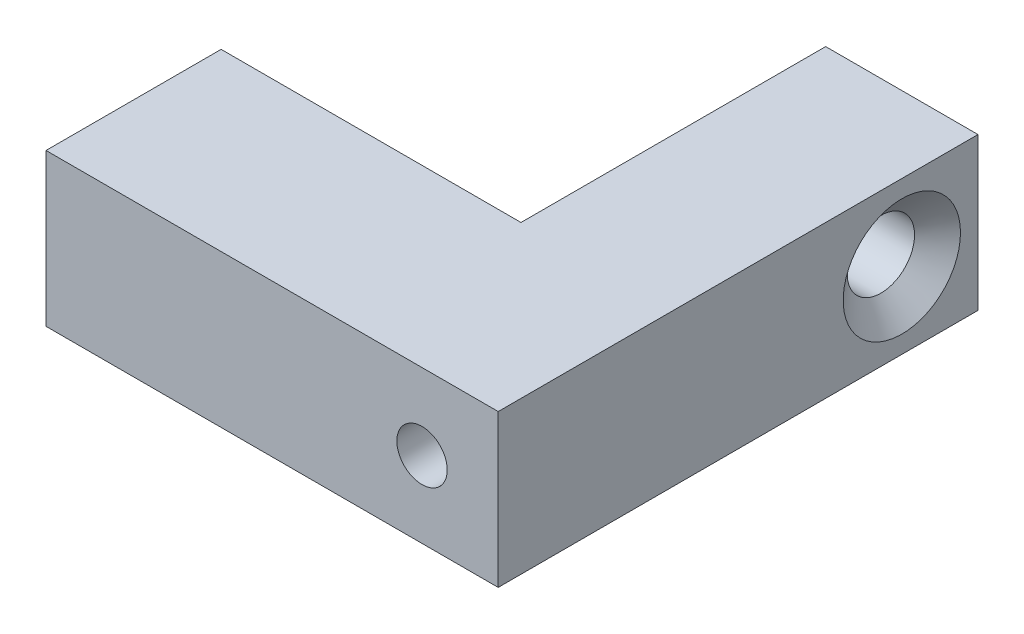
from build123d import *

# Parameters (mm, degrees)
SKETCH1_W                                          = 12.7
SKETCH1_H                                          = 40
BOSS_EXTRUDE1_DEPTH                                = 12.7
CSK_FOR_10_FLAT_HEAD_MACHINE_SCREW_100_D           = 5.6134
CSK_FOR_10_FLAT_HEAD_MACHINE_SCREW_100_DEPTH       = 12.7
CSK_FOR_10_FLAT_HEAD_MACHINE_SCREW_100_CSINK_D     = 9.779
CSK_FOR_10_FLAT_HEAD_MACHINE_SCREW_100_CSINK_ANGLE = 100
CSK_FOR_10_FLAT_HEAD_MACHINE_SCREW_100_TIP         = 1.686435499
TAP_DRILL_FOR_M5X0_8_TAP1_D                        = 4.2
TAP_DRILL_FOR_M5X0_8_TAP1_DEPTH                    = 12.7
TAP_DRILL_FOR_M5X0_8_TAP1_TIP                      = 1.2618073
SKETCH8_W                                          = 14.6
SKETCH8_H                                          = 12.7
BOSS_EXTRUDE2_DEPTH                                = 25


with BuildPart() as part:
    # Sketch1 → Boss-Extrude1 (new body)
    with BuildSketch(Plane(origin=(0, 0, 0), x_dir=(1, 0, 0), z_dir=(0, 1, 0))):
        with Locations((-5.02755102, -8.673469388)):
            Rectangle(SKETCH1_W, SKETCH1_H)
    extrude(amount=BOSS_EXTRUDE1_DEPTH)

    # CSK for #10 Flat Head Machine Screw (100)1
    with Locations(Plane(origin=(1.32244898, 0, 0), x_dir=(0, 0, -1), z_dir=(1, 0, 0))):
        with Locations((4.976530612, 6.35)):
            CounterSinkHole(CSK_FOR_10_FLAT_HEAD_MACHINE_SCREW_100_D / 2, CSK_FOR_10_FLAT_HEAD_MACHINE_SCREW_100_CSINK_D / 2, depth=CSK_FOR_10_FLAT_HEAD_MACHINE_SCREW_100_DEPTH, counter_sink_angle=CSK_FOR_10_FLAT_HEAD_MACHINE_SCREW_100_CSINK_ANGLE)
            with Locations((0, 0, -(CSK_FOR_10_FLAT_HEAD_MACHINE_SCREW_100_DEPTH + CSK_FOR_10_FLAT_HEAD_MACHINE_SCREW_100_TIP / 2))):  # 118° drill point
                Cone(0, CSK_FOR_10_FLAT_HEAD_MACHINE_SCREW_100_D / 2, CSK_FOR_10_FLAT_HEAD_MACHINE_SCREW_100_TIP, mode=Mode.SUBTRACT)

    # Tap Drill for M5x0.8 Tap1
    with Locations(Plane.XY.offset(28.673469388)):
        with Locations((-5.02755102, 6.35)):
            Hole(TAP_DRILL_FOR_M5X0_8_TAP1_D / 2, depth=TAP_DRILL_FOR_M5X0_8_TAP1_DEPTH)
            with Locations((0, 0, -(TAP_DRILL_FOR_M5X0_8_TAP1_DEPTH + TAP_DRILL_FOR_M5X0_8_TAP1_TIP / 2))):  # 118° drill point
                Cone(0, TAP_DRILL_FOR_M5X0_8_TAP1_D / 2, TAP_DRILL_FOR_M5X0_8_TAP1_TIP, mode=Mode.SUBTRACT)

    # Sketch8 → Boss-Extrude2 (add)
    with BuildSketch(Plane.ZY.offset(11.37755102)):
        with Locations((21.373469388, 6.35)):
            Rectangle(SKETCH8_W, SKETCH8_H)
    extrude(amount=BOSS_EXTRUDE2_DEPTH)


solid = part.part
